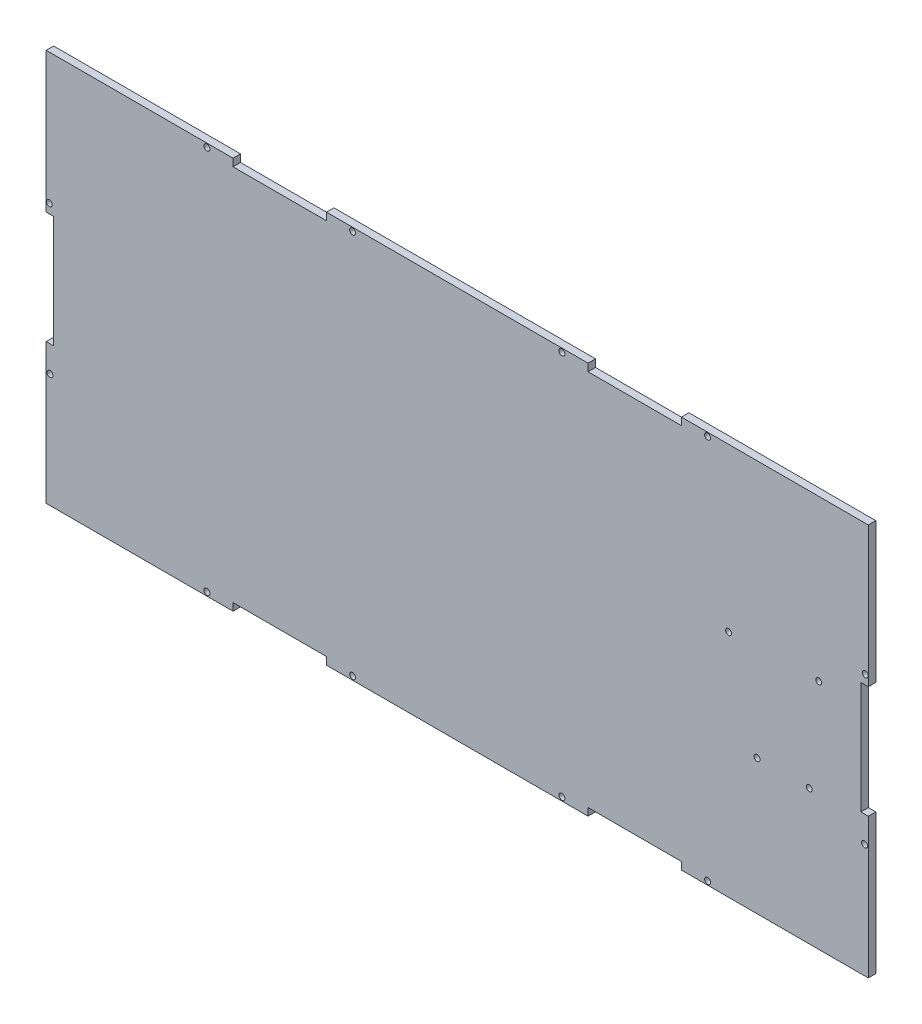
from build123d import *

# Parameters (mm, degrees)
ESQUISSE1_W             = 440
ESQUISSE1_H             = 210
BOSS_EXTRU_1_DEPTH      = 4
ESQUISSE2_W             = 50
ESQUISSE2_H             = 4
ESQUISSE2_W_2           = 4
ESQUISSE2_H_2           = 60
ENL_V_MAT_EXTRU_1_DEPTH = 4
ESQUISSE4_R             = 1.6
ENL_V_MAT_EXTRU_2_DEPTH = 10
ESQUISSE5_R             = 1.5875
ESQUISSE5_R_2           = 1.598396888
ENL_V_MAT_EXTRU_3_DEPTH = 4


with BuildPart() as part:
    # Esquisse1 → Boss.-Extru.1 (new body)
    with BuildSketch(Plane.XY):
        Rectangle(ESQUISSE1_W, ESQUISSE1_H)
    extrude(amount=BOSS_EXTRU_1_DEPTH)

    # Esquisse2 → Enlèv. mat.-Extru.1 (cut)
    with BuildSketch(Plane.XY.offset(4)):
        with Locations((-95, 103)):
            Rectangle(ESQUISSE2_W, ESQUISSE2_H)
        with Locations((95, 103)):
            Rectangle(ESQUISSE2_W, ESQUISSE2_H)
        with Locations((218, 0)):
            Rectangle(ESQUISSE2_W_2, ESQUISSE2_H_2)
        with Locations((-218, 0)):
            Rectangle(ESQUISSE2_W_2, ESQUISSE2_H_2)
        with Locations((95, -103)):
            Rectangle(ESQUISSE2_W, ESQUISSE2_H)
        with Locations((-95, -103)):
            Rectangle(ESQUISSE2_W, ESQUISSE2_H)
    extrude(amount=-ENL_V_MAT_EXTRU_1_DEPTH, mode=Mode.SUBTRACT)

    # Esquisse4 → Enlèv. mat.-Extru.2 (cut)
    with BuildSketch(Plane.XY.offset(4)):
        with Locations((218, -44)):
            Circle(ESQUISSE4_R)
        with Locations((218.375135888, 35)):
            Circle(ESQUISSE4_R)
        with Locations((-56, 103)):
            Circle(ESQUISSE4_R)
        with Locations((-134, 103)):
            Circle(ESQUISSE4_R)
        with Locations((-218.375135888, 35)):
            Circle(ESQUISSE4_R)
        with Locations((-56, -103)):
            Circle(ESQUISSE4_R)
        with Locations((-134, -103)):
            Circle(ESQUISSE4_R)
        with Locations((134, 103)):
            Circle(ESQUISSE4_R)
        with Locations((56, 103)):
            Circle(ESQUISSE4_R)
        with Locations((-218, -44)):
            Circle(ESQUISSE4_R)
        with Locations((56, -103)):
            Circle(ESQUISSE4_R)
        with Locations((134, -103)):
            Circle(ESQUISSE4_R)
    extrude(amount=-ENL_V_MAT_EXTRU_2_DEPTH, mode=Mode.SUBTRACT)

    # Esquisse5 → Enlèv. mat.-Extru.3 (cut)
    with BuildSketch(Plane(origin=(0, 0, 0), x_dir=(-1, 0, 0), z_dir=(0, 0, -1))):
        with Locations((-145.216701852, 18.010439522)):
            Circle(ESQUISSE5_R)
        with Locations((-160.435580246, -32.780039682)):
            Circle(ESQUISSE5_R_2)
        with Locations((-188.38, -32.79)):
            Circle(ESQUISSE5_R)
        with Locations((-193.46, 19.28)):
            Circle(ESQUISSE5_R)
    extrude(amount=-ENL_V_MAT_EXTRU_3_DEPTH, mode=Mode.SUBTRACT)


solid = part.part
